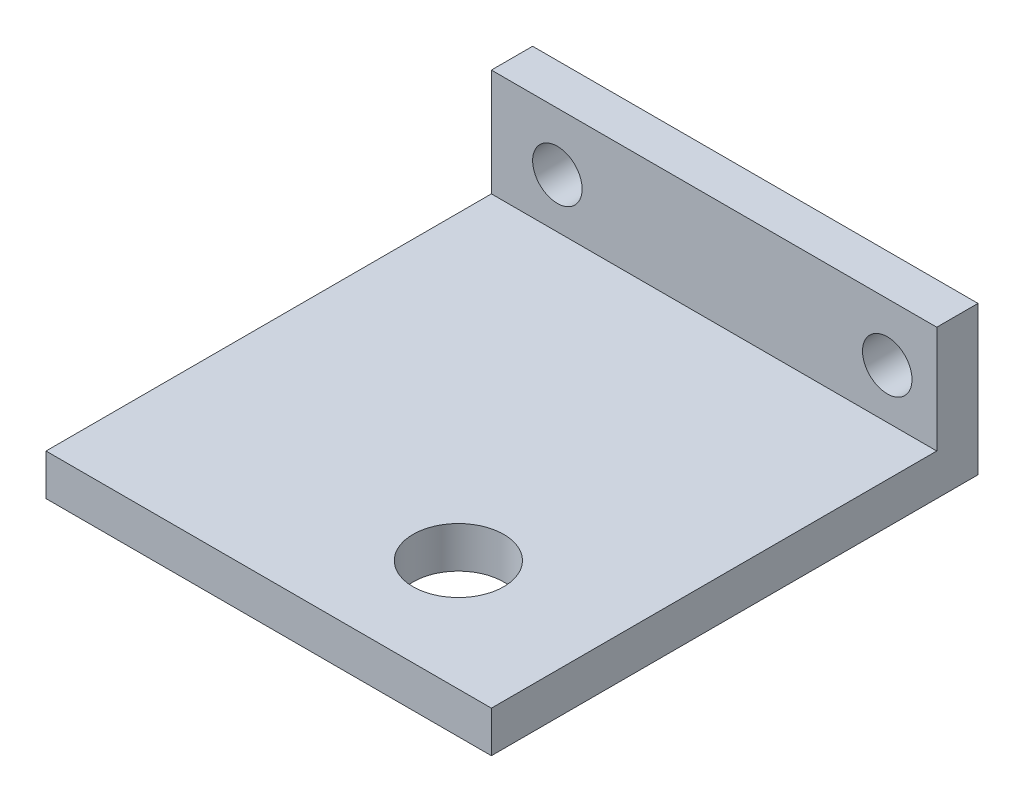
from build123d import *

# Parameters (mm, degrees)
ESQUISSE1_W             = 54
ESQUISSE1_H             = 18
ESQUISSE1_R             = 3
BOSS_EXTRU_1_DEPTH      = 59
ESQUISSE2_W             = 89.885876072
ESQUISSE2_H             = 74.564815434
ENL_V_MAT_EXTRU_1_DEPTH = 13
D_GAGEMENT_M101_D       = 11


with BuildPart() as part:
    # Esquisse1 → Boss.-Extru.1 (new body)
    with BuildSketch(Plane.XY):
        Rectangle(ESQUISSE1_W, ESQUISSE1_H)
        with Locations((-19, 2)):
            Circle(ESQUISSE1_R, mode=Mode.SUBTRACT)
        with Locations((21, 2)):
            Circle(ESQUISSE1_R, mode=Mode.SUBTRACT)
    extrude(amount=BOSS_EXTRU_1_DEPTH)

    # Esquisse2 → Enlèv. mat.-Extru.1 (cut)
    with BuildSketch(Plane(origin=(0, 9, 0), x_dir=(1, 0, 0), z_dir=(0, 1, 0))):
        with Locations((-2.437014962, -42.282407717)):
            Rectangle(ESQUISSE2_W, ESQUISSE2_H)
    extrude(amount=-ENL_V_MAT_EXTRU_1_DEPTH, mode=Mode.SUBTRACT)

    # Dégagement M101 (through all)
    with Locations(Plane(origin=(0, -4, 0), x_dir=(1, 0, 0), z_dir=(0, 1, 0))):
        with Locations((9.500000001, -45.5022105)):
            Hole(D_GAGEMENT_M101_D / 2)


solid = part.part
